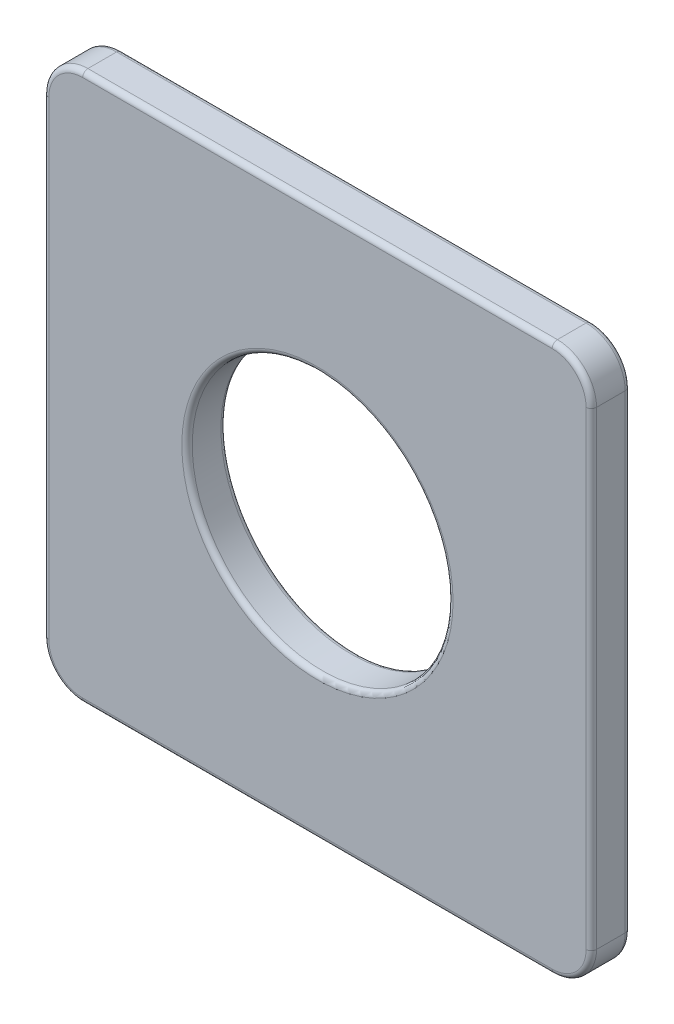
from build123d import *

# Parameters (mm, degrees)
SKETCH1_W           = 21
SKETCH1_H           = 21
BOSS_EXTRUDE1_DEPTH = 0.75
FILLET1_R           = 1.5
SKETCH2_R           = 5
CUT_EXTRUDE1_DEPTH  = 15.924811557
FILLET2_R           = 0.2


with BuildPart() as part:
    # Sketch1 → Boss-Extrude1 (new, symmetric)
    with BuildSketch(Plane.XY):
        Rectangle(SKETCH1_W, SKETCH1_H)
    extrude(amount=BOSS_EXTRUDE1_DEPTH, both=True)

    # Fillet1
    fillet1_edges = [part.edges().sort_by_distance(p)[0] for p in [
        (-10.5, 10.5, 0),
        (10.5, 10.5, 0),
        (10.5, -10.5, 0),
        (-10.5, -10.5, 0),
    ]]
    fillet(fillet1_edges, radius=FILLET1_R)

    # Sketch2 → Cut-Extrude1 (cut, through all)
    with BuildSketch(Plane(origin=(0, 0, -0.75), x_dir=(-1, 0, 0), z_dir=(0, 0, -1))):
        Circle(SKETCH2_R)
    extrude(amount=-CUT_EXTRUDE1_DEPTH, mode=Mode.SUBTRACT)

    # Fillet2
    fillet2_edges = [part.edges().sort_by_distance(p)[0] for p in [
        (-10.5, 0, -0.75),
        (-10.5, 0, 0.75),
        (0, 10.5, -0.75),
        (10.5, 0, -0.75),
        (0, -10.5, -0.75),
        (10.060660172, 10.060660172, -0.75),
        (-10.060660172, -10.060660172, -0.75),
        (10.060660172, -10.060660172, -0.75),
        (-10.060660172, 10.060660172, -0.75),
        (0, 10.5, 0.75),
        (0, -10.5, 0.75),
        (10.5, 0, 0.75),
        (10.060660172, 10.060660172, 0.75),
        (-10.060660172, -10.060660172, 0.75),
        (10.060660172, -10.060660172, 0.75),
        (-10.060660172, 10.060660172, 0.75),
        (5, 0, 0.75),
        (5, 0, -0.75),
    ]]
    fillet(fillet2_edges, radius=FILLET2_R)


solid = part.part
